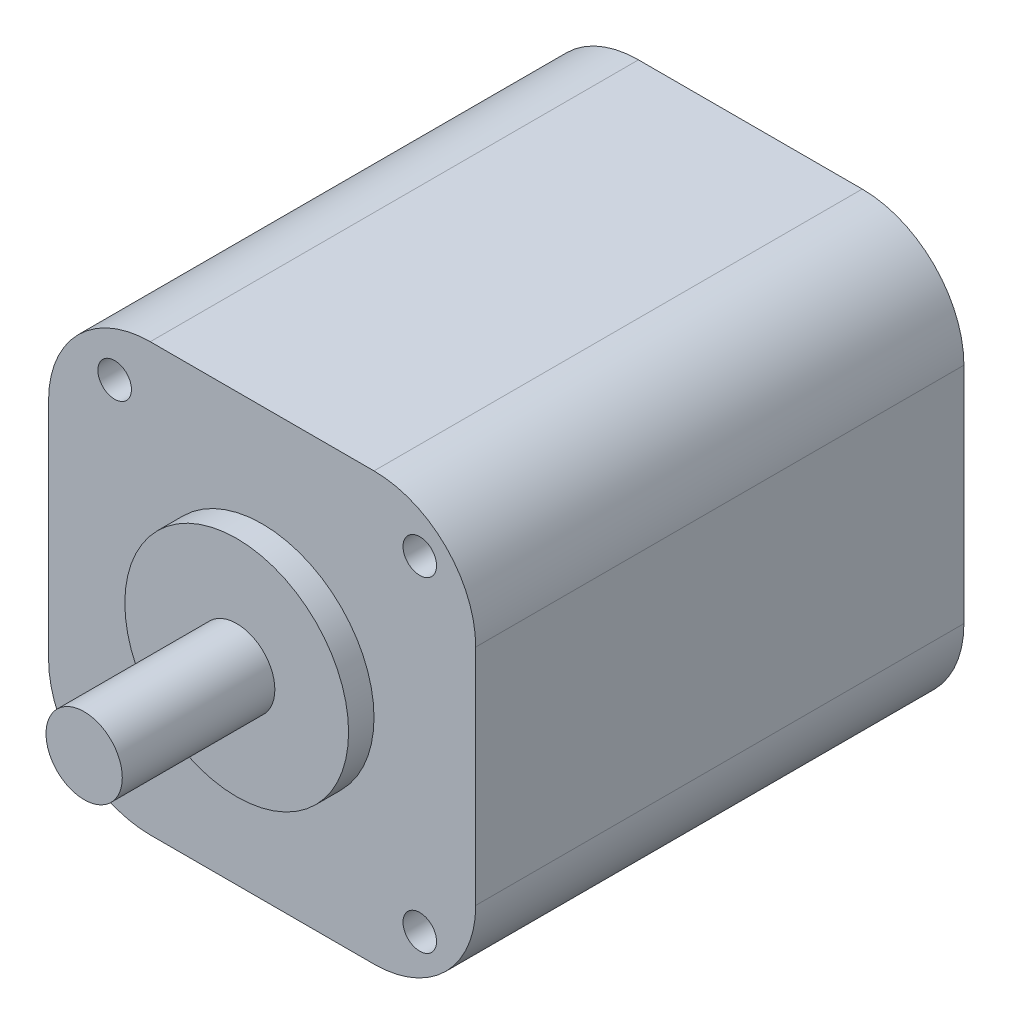
from build123d import *

# Parameters (mm, degrees)
SKETCH_1_W         = 42
SKETCH_1_H         = 42
EXTRUDE_1_DEPTH    = 48
FILLET_1_R         = 10
SKETCH_2_R         = 11
EXTRUDE_2_DEPTH    = 2.5
SKETCH_3_R         = 3.75
EXTRUDE_3_DEPTH    = 15
HOLE_WIZARD_M4_1_D = 3.3


with BuildPart() as part:
    # 草图1 → 凸台-拉伸1 (new body)
    with BuildSketch(Plane.XY):
        with Locations((-24.739017766, 0.699593909)):
            Rectangle(SKETCH_1_W, SKETCH_1_H)
    extrude(amount=EXTRUDE_1_DEPTH)

    # 圆角1
    fillet_1_edges = [part.edges().sort_by_distance(p)[0] for p in [
        (-45.739017766, 21.699593909, 24),
        (-3.739017766, 21.699593909, 24),
        (-3.739017766, -20.300406091, 24),
        (-45.739017766, -20.300406091, 24),
    ]]
    fillet(fillet_1_edges, radius=FILLET_1_R)

    # 草图2 → 凸台-拉伸2 (add)
    with BuildSketch(Plane.XY.offset(48)):
        with Locations((-24.739017766, 0.699593909)):
            Circle(SKETCH_2_R)
    extrude(amount=EXTRUDE_2_DEPTH)

    # 草图3 → 凸台-拉伸3 (add)
    with BuildSketch(Plane.XY.offset(50.5)):
        with Locations((-24.739017766, 0.699593909)):
            Circle(SKETCH_3_R)
    extrude(amount=EXTRUDE_3_DEPTH)

    # M4 螺纹孔1 (through all)
    with Locations(Plane(origin=(0, 0, 0), x_dir=(-1, 0, 0), z_dir=(0, 0, -1))):
        with Locations((9.239017766, 16.699593909), (9.239017766, -15.300406091), (39.239017766, -15.300406091), (39.239017766, 16.699593909)):
            Hole(HOLE_WIZARD_M4_1_D / 2)


solid = part.part
